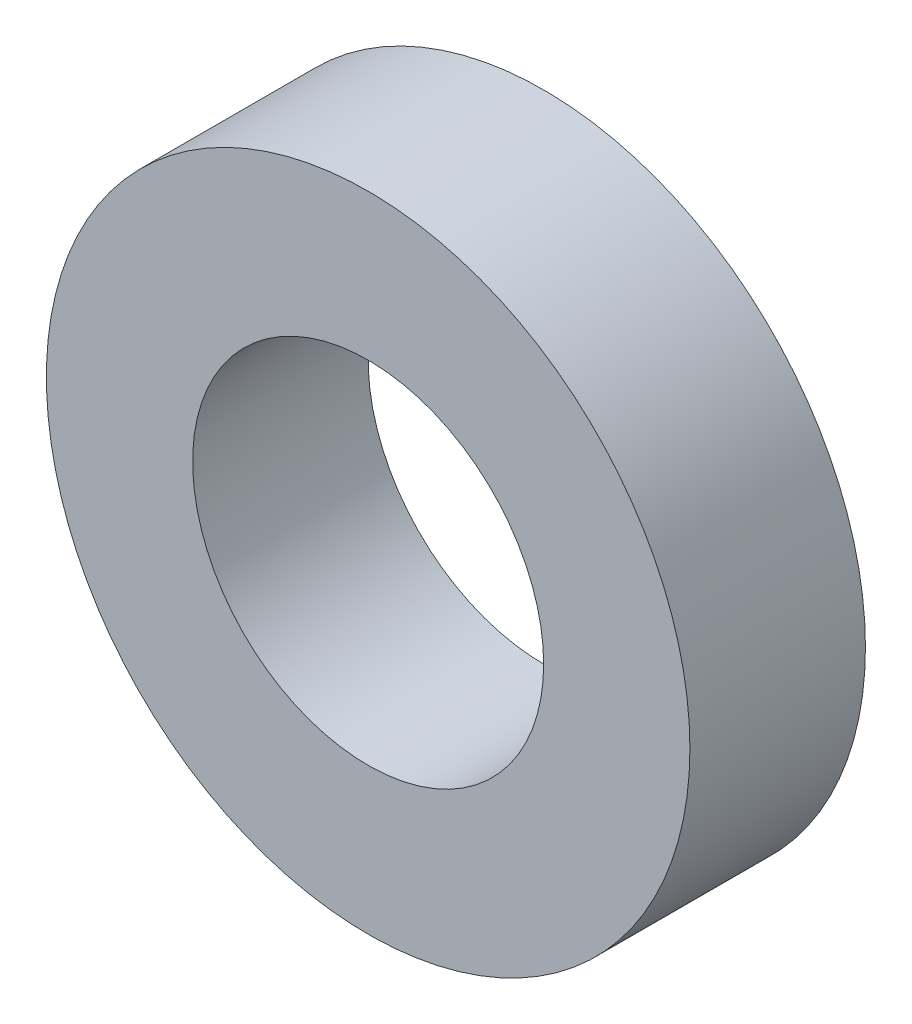
from build123d import *

# Parameters (mm, degrees)
SKETCH_1_R      = 2.75
SKETCH_1_R_2    = 1.5
EXTRUDE_1_DEPTH = 1.5


with BuildPart() as part:
    # 草图1 → 凸台-拉伸1 (new body)
    with BuildSketch(Plane.XY):
        Circle(SKETCH_1_R)
        Circle(SKETCH_1_R_2, mode=Mode.SUBTRACT)
    extrude(amount=EXTRUDE_1_DEPTH)


solid = part.part
